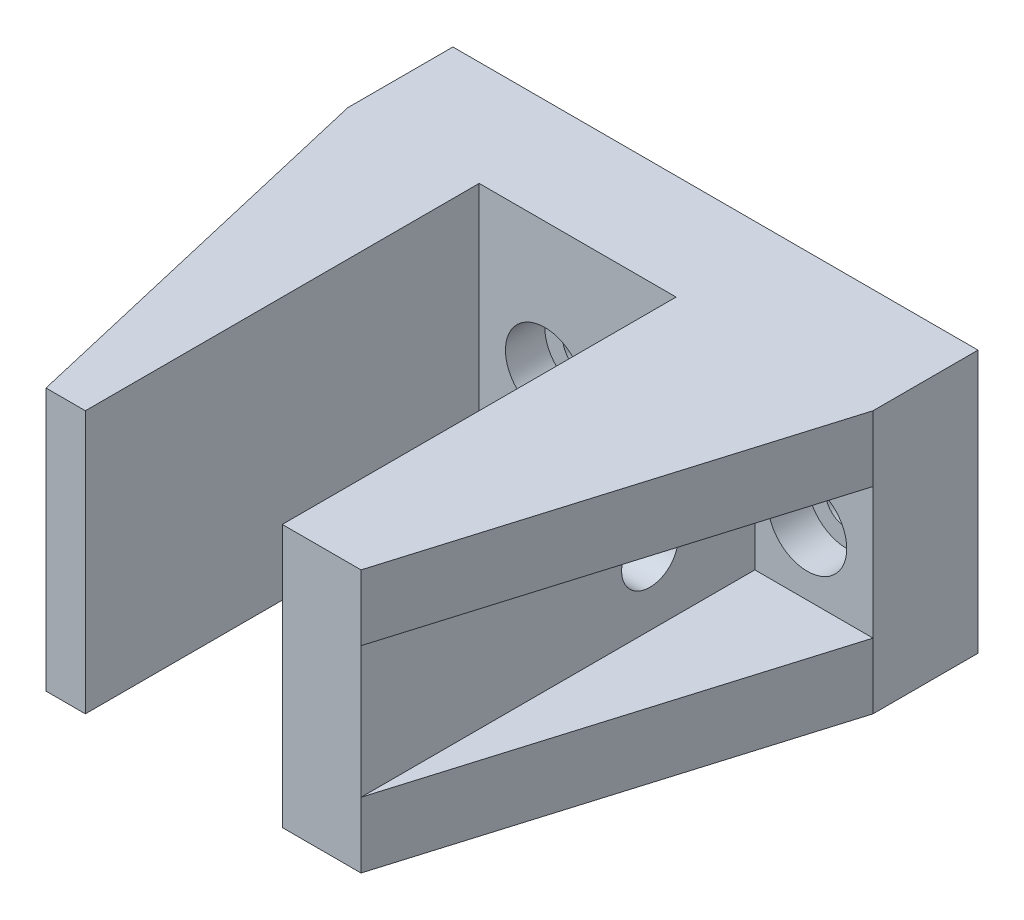
from build123d import *

# Parameters (mm, degrees)
SKETCH1_W           = 40
SKETCH1_H           = 20
SKETCH1_R           = 1.65
BOSS_EXTRUDE1_DEPTH = 8
SKETCH3_W           = 3
SKETCH3_H           = 20
SKETCH3_W_2         = 6
BOSS_EXTRUDE2_DEPTH = 30
BOSS_EXTRUDE3_DEPTH = 20
SKETCH6_W           = 7
SKETCH6_H           = 10
SKETCH6_W_2         = 9
CUT_EXTRUDE2_DEPTH  = 30
SKETCH7_R           = 2.15
CUT_EXTRUDE3_DEPTH  = 6
CUT_EXTRUDE4_DEPTH  = 2.5
SKETCH10_R          = 3
CUT_EXTRUDE5_DEPTH  = 3


with BuildPart() as part:
    # Sketch1 → Boss-Extrude1 (new body)
    with BuildSketch(Plane.XY):
        Rectangle(SKETCH1_W, SKETCH1_H)
        with Locations((-5, 0)):
            Circle(SKETCH1_R, mode=Mode.SUBTRACT)
        with Locations((14.999778189, -0.094193404)):
            Circle(SKETCH1_R, mode=Mode.SUBTRACT)
    extrude(amount=BOSS_EXTRUDE1_DEPTH)

    # Sketch3 → Boss-Extrude2 (add)
    with BuildSketch(Plane.XY.offset(8)):
        with Locations((-11.5, 0)):
            Rectangle(SKETCH3_W, SKETCH3_H)
        with Locations((8, 0)):
            Rectangle(SKETCH3_W_2, SKETCH3_H)
    extrude(amount=BOSS_EXTRUDE2_DEPTH)

    # Sketch5 → Boss-Extrude3 (add)
    with BuildSketch(Plane(origin=(0, 10, 0), x_dir=(1, 0, 0), z_dir=(0, 1, 0))):
        Polygon((-20, -8), (-13, -38), (-13, -8), align=None)
        Polygon((20, -8), (11, -8), (11, -38), align=None)
    extrude(amount=-BOSS_EXTRUDE3_DEPTH)

    # Sketch6 → Cut-Extrude2 (cut)
    with BuildSketch(Plane.XY.offset(38)):
        with Locations((-16.5, 0)):
            Rectangle(SKETCH6_W, SKETCH6_H)
        with Locations((15.5, 0)):
            Rectangle(SKETCH6_W_2, SKETCH6_H)
    extrude(amount=-CUT_EXTRUDE2_DEPTH, mode=Mode.SUBTRACT)

    # Sketch7 → Cut-Extrude3 (cut)
    with BuildSketch(Plane(origin=(11, 0, 0), x_dir=(0, 0, -1), z_dir=(1, 0, 0))):
        with Locations(Location((-16, 0, 0), (0, 0, 90))):
            Circle(SKETCH7_R)
    extrude(amount=-CUT_EXTRUDE3_DEPTH, mode=Mode.SUBTRACT)

    # Sketch8 → Cut-Extrude4 (cut)
    with BuildSketch(Plane.ZY.offset(-5)):
        Polygon((19.55, 2.049593456), (16, 4.099186911), (12.45, 2.049593456), (12.45, -2.049593456), (16, -4.099186911), (19.55, -2.049593456), align=None)
    extrude(amount=-CUT_EXTRUDE4_DEPTH, mode=Mode.SUBTRACT)

    # Sketch10 → Cut-Extrude5 (cut)
    with BuildSketch(Plane.XY.offset(8)):
        with Locations((-5, 0)):
            Circle(SKETCH10_R)
        with Locations((14.999778189, -0.094193404)):
            Circle(SKETCH10_R)
    extrude(amount=-CUT_EXTRUDE5_DEPTH, mode=Mode.SUBTRACT)


solid = part.part
